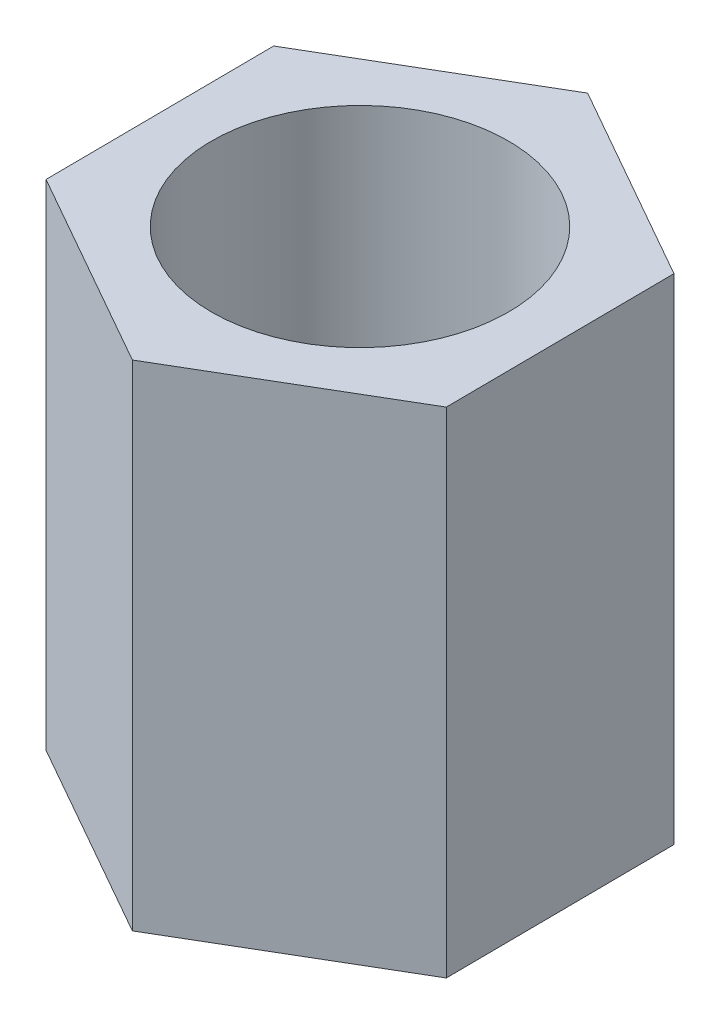
from build123d import *

# Parameters (mm, degrees)
SKETCH_1_R      = 1.5
EXTRUDE_1_DEPTH = 5


with BuildPart() as part:
    # 草图1 → 凸台-拉伸1 (new body)
    with BuildSketch(Plane(origin=(0, 0, 0), x_dir=(1, 0, 0), z_dir=(0, 1, 0))):
        Polygon((2, 1.175069723), (-0.017640231, 2.319585669), (-2.017640231, 1.144515946), (-2, -1.175069723), (0.017640231, -2.319585669), (2.017640231, -1.144515946), align=None)
        with Locations(Location((0, 0, 0), (0, 0, 270))):
            Circle(SKETCH_1_R, mode=Mode.SUBTRACT)
    extrude(amount=EXTRUDE_1_DEPTH)


solid = part.part
